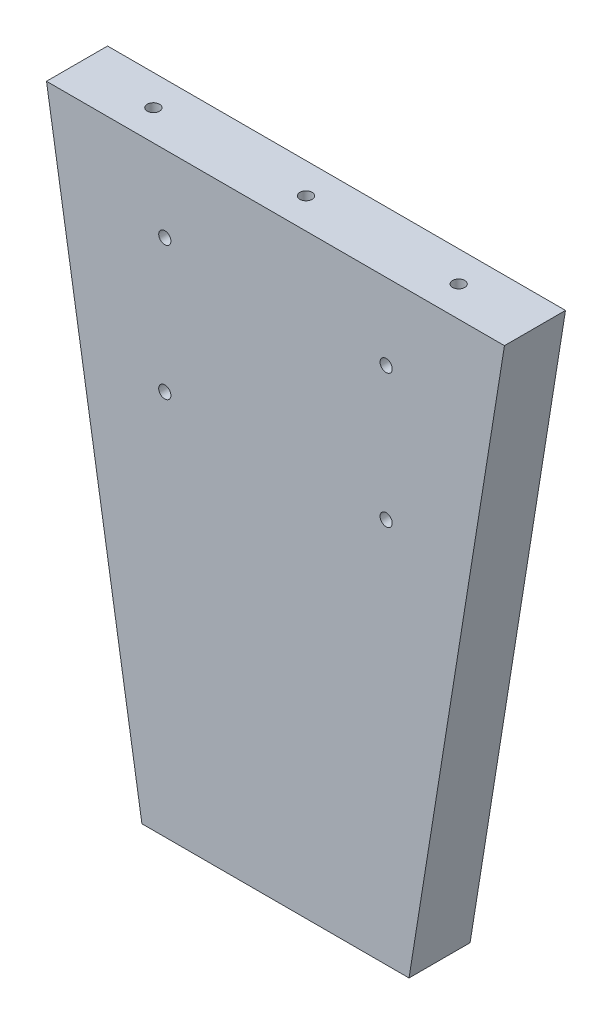
from build123d import *

# Parameters (mm, degrees)
DODANIE_WYCI_GNI_CIE1_DEPTH                       = 8
POG_BIENIE_STO_KOWE_POD_M3_WKR_T_DO_2_COUNT       = 2
POG_BIENIE_STO_KOWE_POD_M3_WKR_T_DO_2_PITCH       = 35
SZYK_LINIOWY2_COUNT                               = 2
SZYK_LINIOWY2_PITCH                               = 58
POG_BIENIE_STO_KOWE_POD_M3_WKR_T_DO_3_D           = 3.2
POG_BIENIE_STO_KOWE_POD_M3_WKR_T_DO_3_DEPTH       = 40
POG_BIENIE_STO_KOWE_POD_M3_WKR_T_DO_3_CSINK_D     = 6.3
POG_BIENIE_STO_KOWE_POD_M3_WKR_T_DO_3_CSINK_ANGLE = 90
POG_BIENIE_STO_KOWE_POD_M3_WKR_T_DO_3_TIP         = 0.96137699


with BuildPart() as part:
    # Szkic1 → Dodanie-wyciągnięcie1 (new, symmetric)
    with BuildSketch(Plane.XY):
        Polygon((35, 0), (0, 0), (0, 156), (60, 156), align=None)
    dodanie_wyci_gni_cie1 = extrude(amount=DODANIE_WYCI_GNI_CIE1_DEPTH, both=True)

    # Lustro1: Dodanie-wyciągnięcie1 across plane
    add(dodanie_wyci_gni_cie1.mirror(Plane(origin=(0, 0, 8), x_dir=(0, 0, 1), z_dir=(1, 0, 0))))

    # Szkic5 → Pog_bienie sto_kowe pod M3 wkr_t do cz_c (revolve, cut)
    with BuildSketch(Plane(origin=(29, 101, -8), x_dir=(0, 1, 0), z_dir=(1, 0, 0))):
        Polygon((0, 0), (0, 40.96137699), (1.6, 40), (1.6, 1.55), (3.15, 0), align=None)
    pog_bienie_sto_kowe_pod_m3_wkr_t_do_cz_c = revolve(axis=Axis((29, 101, -14.35), (0, 0, 1)), mode=Mode.SUBTRACT)

    # Pog_bienie sto_kowe pod M3 wkr_t do  2: Pog_bienie sto_kowe pod M3 wkr_t do cz_c ×2
    with Locations(*[(0, i * POG_BIENIE_STO_KOWE_POD_M3_WKR_T_DO_2_PITCH, 0) for i in range(1, POG_BIENIE_STO_KOWE_POD_M3_WKR_T_DO_2_COUNT)]):
        add(pog_bienie_sto_kowe_pod_m3_wkr_t_do_cz_c, mode=Mode.SUBTRACT)

    # Szyk liniowy2: Pog_bienie sto_kowe pod M3 wkr_t do cz_c ×2
    with Locations(*[(-i * SZYK_LINIOWY2_PITCH, 0, 0) for i in range(1, SZYK_LINIOWY2_COUNT)]):
        add(pog_bienie_sto_kowe_pod_m3_wkr_t_do_cz_c, mode=Mode.SUBTRACT)

    # Szyk liniowy2 copy 1 sketch → Szyk liniowy2 copy 1 (revolve, cut)
    with BuildSketch(Plane(origin=(-29, 136, -8), x_dir=(0, 1, 0), z_dir=(1, 0, 0))):
        Polygon((0, 0), (0, 40.96137699), (1.6, 40), (1.6, 1.55), (3.15, 0), align=None)
    revolve(axis=Axis((-29, 136, -14.35), (0, 0, 1)), mode=Mode.SUBTRACT)

    # Pog_bienie sto_kowe pod M3 wkr_t do  3
    with Locations(Plane(origin=(-255, 172, 61), x_dir=(1, 0, 0), z_dir=(0, 1, 0))):
        with Locations((295, 61), (284, 28), (226, 28), (226, 48), (255, 61), (215, 61), (284, 48)):
            CounterSinkHole(POG_BIENIE_STO_KOWE_POD_M3_WKR_T_DO_3_D / 2, POG_BIENIE_STO_KOWE_POD_M3_WKR_T_DO_3_CSINK_D / 2, depth=POG_BIENIE_STO_KOWE_POD_M3_WKR_T_DO_3_DEPTH, counter_sink_angle=POG_BIENIE_STO_KOWE_POD_M3_WKR_T_DO_3_CSINK_ANGLE)
            with Locations((0, 0, -(POG_BIENIE_STO_KOWE_POD_M3_WKR_T_DO_3_DEPTH + POG_BIENIE_STO_KOWE_POD_M3_WKR_T_DO_3_TIP / 2))):  # 118° drill point
                Cone(0, POG_BIENIE_STO_KOWE_POD_M3_WKR_T_DO_3_D / 2, POG_BIENIE_STO_KOWE_POD_M3_WKR_T_DO_3_TIP, mode=Mode.SUBTRACT)


solid = part.part
